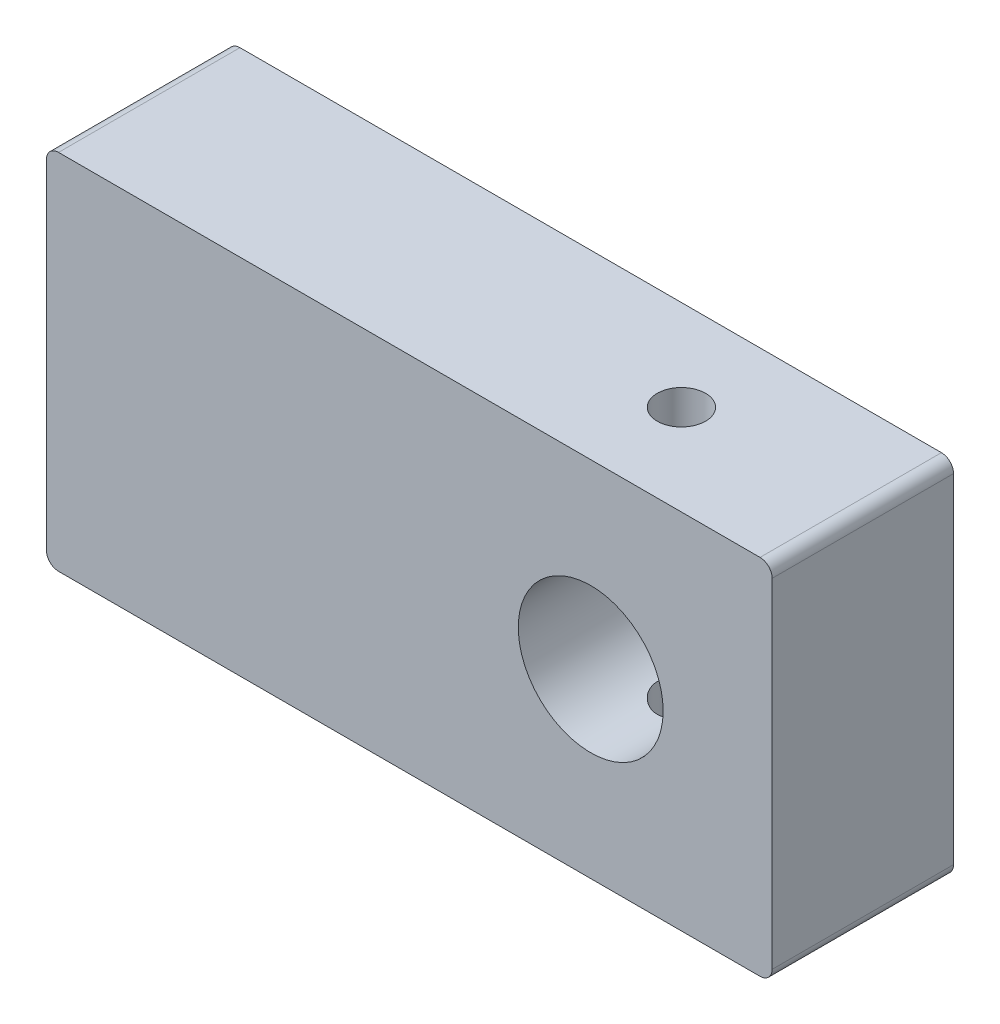
from build123d import *

# Parameters (mm, degrees)
SKETCH1_R           = 5.99
BOSS_EXTRUDE1_DEPTH = 7.5
SKETCH2_R           = 2
CUT_EXTRUDE1_DEPTH  = 15
SKETCH3_R           = 2
CUT_EXTRUDE5_DEPTH  = 35


with BuildPart() as part:
    # Sketch1 → Boss-Extrude1 (new, symmetric)
    with BuildSketch(Plane.XY):
        with BuildLine():
            Line((-29, 15), (29, 15))
            ThreePointArc((29, 15), (29.707106781, 14.707106781), (30, 14))
            Line((30, 14), (30, -14))
            ThreePointArc((30, -14), (29.707106781, -14.707106781), (29, -15))
            Line((29, -15), (-29, -15))
            ThreePointArc((-29, -15), (-29.707106781, -14.707106781), (-30, -14))
            Line((-30, -14), (-30, 14))
            ThreePointArc((-30, 14), (-29.707106781, 14.707106781), (-29, 15))
        make_face()
        with Locations((15, 0)):
            Circle(SKETCH1_R, mode=Mode.SUBTRACT)
    extrude(amount=BOSS_EXTRUDE1_DEPTH, both=True)

    # Sketch2 → Cut-Extrude1 (cut)
    with BuildSketch(Plane.ZY.offset(30)):
        with Locations(Location((0, 8, 0), (0, 0, 270))):
            Circle(SKETCH2_R)
        with Locations(Location((0, -8, 0), (0, 0, 270))):
            Circle(SKETCH2_R)
    extrude(amount=-CUT_EXTRUDE1_DEPTH, mode=Mode.SUBTRACT)

    # Sketch3 → Cut-Extrude5 (cut)
    with BuildSketch(Plane(origin=(0, 15, 0), x_dir=(1, 0, 0), z_dir=(0, 1, 0))):
        with Locations(Location((15, 0, 0), (0, 0, 270))):
            Circle(SKETCH3_R)
    extrude(amount=-CUT_EXTRUDE5_DEPTH, mode=Mode.SUBTRACT)


solid = part.part
